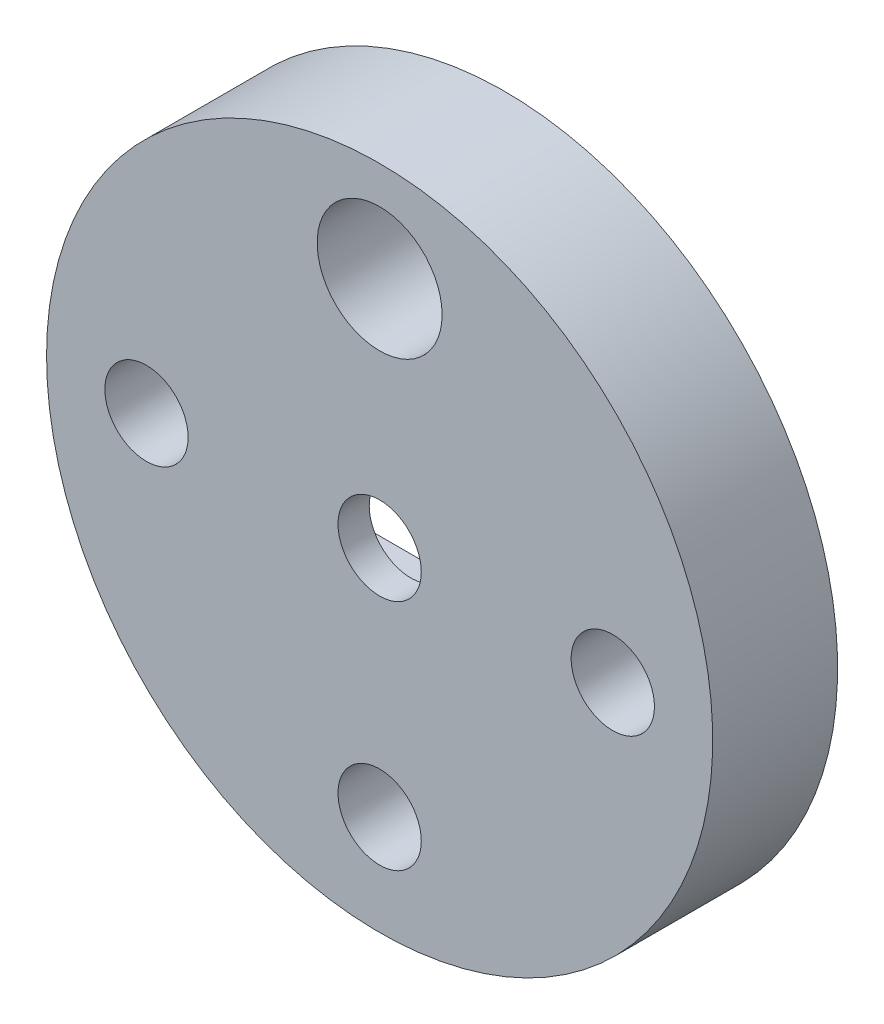
from build123d import *

# Parameters (mm, degrees)
SKETCH1_R           = 25.4
BOSS_EXTRUDE1_DEPTH = 9.525
SKETCH2_W           = 20.6375
SKETCH2_H           = 17.4625
CUT_EXTRUDE1_DEPTH  = 7.14375
SKETCH3_R           = 3.175
CUT_EXTRUDE9_DEPTH  = 15.5575
SKETCH5_R           = 4.7625
SKETCH5_R_2         = 3.175
CUT_EXTRUDE10_DEPTH = 15.5575


with BuildPart() as part:
    # Sketch1 → Boss-Extrude1 (new body)
    with BuildSketch(Plane.XY):
        with Locations(Location((0, 0, 0), (0, 0, 180))):
            Circle(SKETCH1_R)
    extrude(amount=BOSS_EXTRUDE1_DEPTH)

    # Sketch2 → Cut-Extrude1 (cut)
    with BuildSketch(Plane.XY):
        Rectangle(SKETCH2_W, SKETCH2_H)
    extrude(amount=CUT_EXTRUDE1_DEPTH, mode=Mode.SUBTRACT)

    # Sketch3 → Cut-Extrude9 (cut)
    with BuildSketch(Plane(origin=(0, 0, 7.14375), x_dir=(-1, 0, 0), z_dir=(0, 0, -1))):
        Circle(SKETCH3_R)
    extrude(amount=-CUT_EXTRUDE9_DEPTH, mode=Mode.SUBTRACT)

    # Sketch5 → Cut-Extrude10 (cut)
    with BuildSketch(Plane.XY.offset(9.525)):
        with Locations((0, 17.78)):
            Circle(SKETCH5_R)
        with Locations((17.78, 0)):
            Circle(SKETCH5_R_2)
        with Locations((0, -17.768897269)):
            Circle(SKETCH5_R_2)
        with Locations((-17.78, 0)):
            Circle(SKETCH5_R_2)
    extrude(amount=-CUT_EXTRUDE10_DEPTH, mode=Mode.SUBTRACT)


solid = part.part
